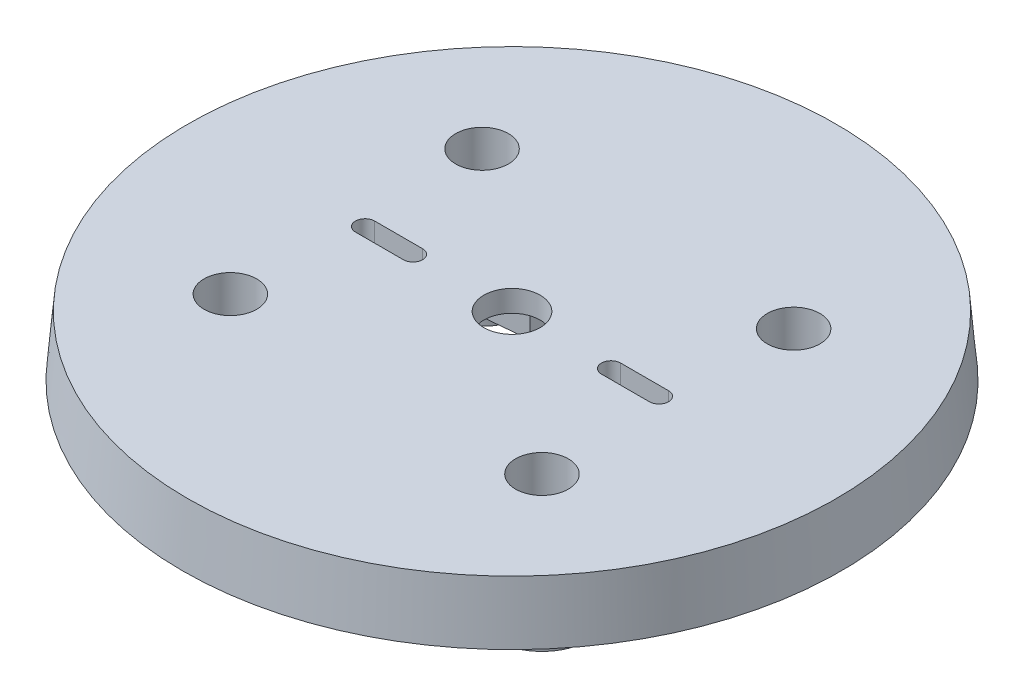
from build123d import *

# Parameters (mm, degrees)
IZIM2_R                     = 27.5
Y_KSEKLIK_EKSTR_ZYON1_DEPTH = 5
Y_KSEKLIK_EKSTR_ZYON1_TAPER = 5
IZIM4_R                     = 3.625
KES_EKSTR_ZYON1_DEPTH       = 2.4
IZIM4_3_R                   = 2.35
KES_EKSTR_ZYON2_DEPTH       = 14
KES_EKSTR_ZYON3_DEPTH       = 3.2
KES_EKSTR_ZYON4_DEPTH       = 3.5
SKETCH1_R                   = 4
BOSS_EXTRUDE1_DEPTH         = 5
SKETCH3_R                   = 2.2
CUT_EXTRUDE1_DEPTH          = 5.2
CHAMFER1_SIZE               = 2.5


with BuildPart() as part:
    # Çizim2 → Yükseklik-Ekstrüzyon1 (new body)
    with BuildSketch(Plane(origin=(0, 0, 0), x_dir=(1, 0, 0), z_dir=(0, 1, 0))):
        Circle(IZIM2_R)
    extrude(amount=Y_KSEKLIK_EKSTR_ZYON1_DEPTH, taper=Y_KSEKLIK_EKSTR_ZYON1_TAPER)

    # Çizim4 → Kes-Ekstrüzyon1 (cut)
    with BuildSketch(Plane.XZ):
        with BuildLine():
            ThreePointArc((15.927868459, -2.388197354), (18.1, 0), (15.927868459, 2.388197354))
            Line((15.927868459, 2.388197354), (2.2, 3.691961397))
            Line((2.2, 3.691961397), (2.2, 7.45))
            ThreePointArc((2.2, 7.45), (0, 9.65), (-2.2, 7.45))
            Line((-2.2, 7.45), (-2.2, 3.691961397))
            Line((-2.2, 3.691961397), (-15.927868459, 2.388197354))
            ThreePointArc((-15.927868459, 2.388197354), (-18.1, 0), (-15.927868459, -2.388197354))
            Line((-15.927868459, -2.388197354), (-2.2, -3.691961397))
            Line((-2.2, -3.691961397), (-2.2, -7.45))
            ThreePointArc((-2.2, -7.45), (0, -9.65), (2.2, -7.45))
            Line((2.2, -7.45), (2.2, -3.691961397))
            Line((2.2, -3.691961397), (15.927868459, -2.388197354))
        make_face()
        Circle(IZIM4_R, mode=Mode.SUBTRACT)
    extrude(amount=-KES_EKSTR_ZYON1_DEPTH, mode=Mode.SUBTRACT)

    # Çizim4<3> → Kes-Ekstrüzyon2 (cut)
    with BuildSketch(Plane.XZ):
        Circle(IZIM4_3_R)
    extrude(amount=-KES_EKSTR_ZYON2_DEPTH, mode=Mode.SUBTRACT)

    # Çizim8 → Kes-Ekstrüzyon3 (cut)
    with BuildSketch(Plane.XZ):
        Polygon((-5, 3.426039609), (-5, -3.426039609), (-2.2, -3.691961397), (2.2, -3.691961397), (5, -3.426039609), (5, 3.426039609), (2.2, 3.691961397), (-2.2, 3.691961397), align=None)
    extrude(amount=-KES_EKSTR_ZYON3_DEPTH, mode=Mode.SUBTRACT)

    # Çizim9 → Kes-Ekstrüzyon4 (cut)
    with BuildSketch(Plane.XZ.offset(-2.4)):
        with BuildLine():
            Line((12.262809511, -0.8), (8.262809511, -0.8))
            ThreePointArc((8.262809511, -0.8), (7.462809511, 0), (8.262809511, 0.8))
            Line((8.262809511, 0.8), (12.262809511, 0.8))
            ThreePointArc((12.262809511, 0.8), (13.062809511, 0), (12.262809511, -0.8))
        make_face()
        with BuildLine():
            Line((-12.262809511, -0.8), (-8.262809511, -0.8))
            ThreePointArc((-8.262809511, -0.8), (-7.462809511, 0), (-8.262809511, 0.8))
            Line((-8.262809511, 0.8), (-12.262809511, 0.8))
            ThreePointArc((-12.262809511, 0.8), (-13.062809511, 0), (-12.262809511, -0.8))
        make_face()
    extrude(amount=-KES_EKSTR_ZYON4_DEPTH, mode=Mode.SUBTRACT)

    # Sketch1 → Boss-Extrude1 (add)
    with BuildSketch(Plane.XZ):
        with Locations((-13, 10.5)):
            Circle(SKETCH1_R)
        with Locations((13, 10.5)):
            Circle(SKETCH1_R)
        with Locations((13, -10.5)):
            Circle(SKETCH1_R)
        with Locations((-13, -10.5)):
            Circle(SKETCH1_R)
    extrude(amount=BOSS_EXTRUDE1_DEPTH)

    # Sketch3 → Cut-Extrude1 (cut)
    with BuildSketch(Plane(origin=(0, 5, 0), x_dir=(1, 0, 0), z_dir=(0, 1, 0))):
        with Locations((13, 10.5)):
            Circle(SKETCH3_R)
        with Locations((-13, 10.5)):
            Circle(SKETCH3_R)
        with Locations((-13, -10.5)):
            Circle(SKETCH3_R)
        with Locations((13, -10.5)):
            Circle(SKETCH3_R)
    extrude(amount=-CUT_EXTRUDE1_DEPTH, mode=Mode.SUBTRACT)

    # Chamfer1
    chamfer1_edges = [part.edges().sort_by_distance(p)[0] for p in [
        (-17, 0, -10.5),
        (9, 0, -10.5),
        (9, 0, 10.5),
        (-17, 0, 10.5),
    ]]
    chamfer(chamfer1_edges, length=CHAMFER1_SIZE)


solid = part.part
